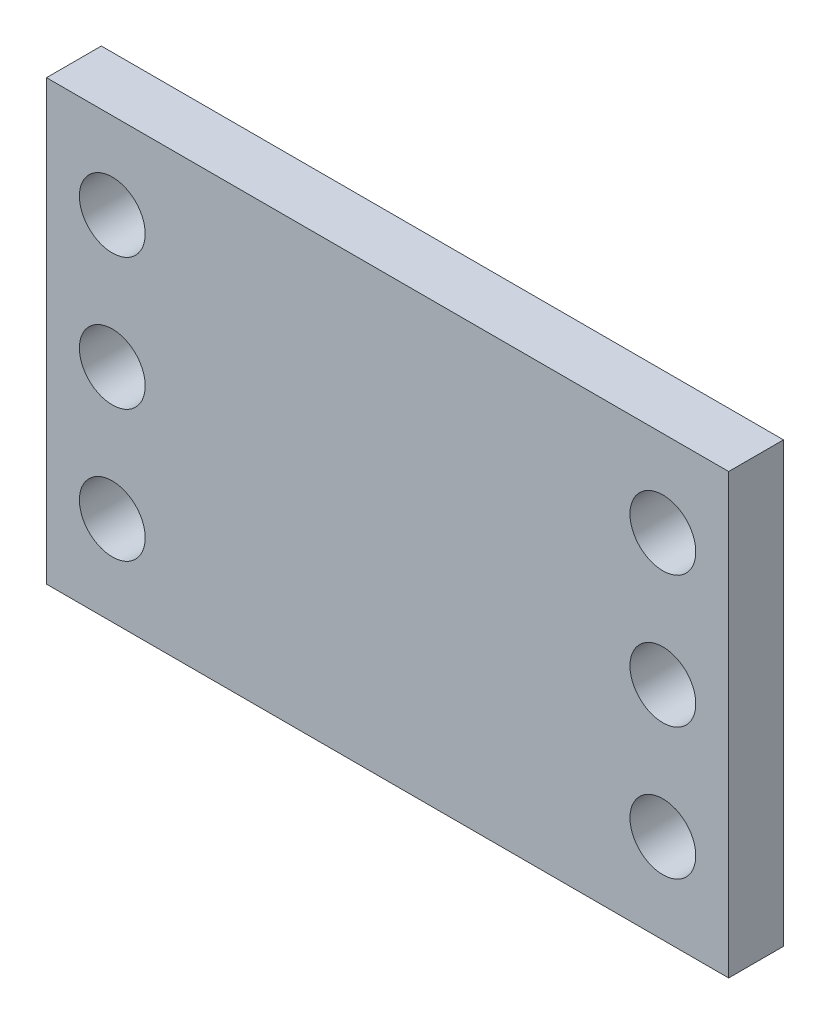
from build123d import *

# Parameters (mm, degrees)
CROQUIS1_W              = 62.206373562
CROQUIS1_H              = 40
SALIENTE_EXTRUIR1_DEPTH = 5
CROQUIS9_R              = 3
CORTAR_EXTRUIR2_DEPTH   = 10


with BuildPart() as part:
    # Croquis1 → Saliente-Extruir1 (new body)
    with BuildSketch(Plane.XY):
        with Locations((69.078310012, 39.240002825)):
            Rectangle(CROQUIS1_W, CROQUIS1_H)
    extrude(amount=SALIENTE_EXTRUIR1_DEPTH)

    # Croquis9 → Cortar-Extruir2 (cut)
    with BuildSketch(Plane(origin=(0, 0, 0), x_dir=(-1, 0, 0), z_dir=(0, 0, -1))):
        with Locations((-94.181496793, 27.39443436)):
            Circle(CROQUIS9_R)
        with Locations((-94.181496793, 39.39443436)):
            Circle(CROQUIS9_R)
        with Locations((-94.181496793, 51.39443436)):
            Circle(CROQUIS9_R)
        with Locations((-43.975123231, 27.39443436)):
            Circle(CROQUIS9_R)
        with Locations((-43.975123231, 39.39443436)):
            Circle(CROQUIS9_R)
        with Locations((-43.975123231, 51.39443436)):
            Circle(CROQUIS9_R)
    extrude(amount=-CORTAR_EXTRUIR2_DEPTH, mode=Mode.SUBTRACT)


solid = part.part
